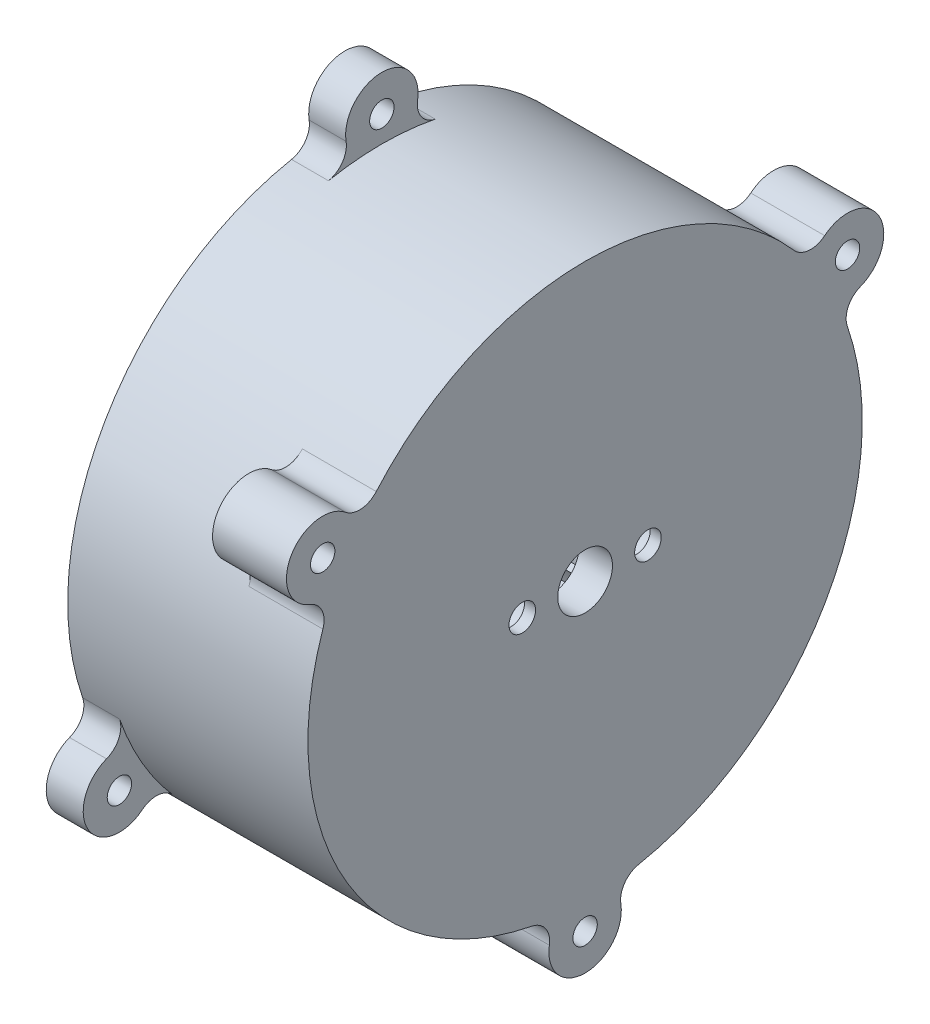
from build123d import *

# Parameters (mm, degrees)
BASPROSKE_W         = 28
BASPROSKE_H         = 4.375
TOOTHCUT_DEPTH      = 60.970826241
TEETHCUTS_COUNT     = 55
TEETHCUTS_ANGLE     = 353.454545455
BOSS_EXTRUDE1_START = 4.5
SKETCH1_R           = 37.5
BOSS_EXTRUDE1_DEPTH = 4.5
SKETCH2_R           = 3.7
SKETCH2_R_2         = 1.8
CUT_EXTRUDE1_DEPTH  = 4.5
SKETCH3_R           = 3.25
CUT_EXTRUDE2_DEPTH  = 3
BOSS_EXTRUDE2_START = -5
SKETCH4_R           = 1.65
BOSS_EXTRUDE2_DEPTH = 5
FILLET1_R           = 3
SKETCH5_R           = 1.65
BOSS_EXTRUDE3_DEPTH = 10
FILLET2_R           = 3


with BuildPart() as part:
    # BasProSke → Base-Revolve (revolve)
    with BuildSketch(Plane(origin=(0, 0, 0), x_dir=(1, 0, 0), z_dir=(0, 1, 0)), mode=Mode.PRIVATE) as base_revolve_sk:
        with Locations((14, 35.3125)):
            Rectangle(BASPROSKE_W, BASPROSKE_H)
    revolve(base_revolve_sk.sketch.rotate(Axis((-10, 0, 0), (1, 0, 0)), 180), axis=Axis((-10, 0, 0), (1, 0, 0)))

    # TooCutSke → ToothCut (cut, through all)
    with BuildSketch(Plane(origin=(0, 0, 0), x_dir=(0, 0, -1), z_dir=(1, 0, 0))):
        with BuildLine():
            ThreePointArc((1.451447951, 33.067761022), (1.040603726, 34.522224287), (0.503573985, 35.934971761))
            ThreePointArc((0.503573985, 35.934971761), (0, 35.9385), (-0.503573985, 35.934971761))
            ThreePointArc((-0.503573985, 35.934971761), (-1.040603726, 34.522224287), (-1.451447951, 33.067761022))
            ThreePointArc((-1.451447951, 33.067761022), (0, 33.0996), (1.451447951, 33.067761022))
        make_face()
    toothcut = extrude(amount=TOOTHCUT_DEPTH, mode=Mode.SUBTRACT)

    # TeethCuts: ToothCut ×55 about axis
    teethcuts_axis = Axis((-10, 0, 0), (1, 0, 0))
    for i in range(1, TEETHCUTS_COUNT):
        add(toothcut.rotate(teethcuts_axis, i * TEETHCUTS_ANGLE / (TEETHCUTS_COUNT - 1)), mode=Mode.SUBTRACT)

    # Sketch1 → Boss-Extrude1 (add)
    with BuildSketch(Plane(origin=(28, 0, 0), x_dir=(0, 0, -1), z_dir=(1, 0, 0)).offset(BOSS_EXTRUDE1_START)):
        with Locations(Location((0, 0, 0), (0, 0, 180))):
            Circle(SKETCH1_R)
    extrude(amount=-BOSS_EXTRUDE1_DEPTH)

    # Sketch2 → Cut-Extrude1 (cut)
    with BuildSketch(Plane(origin=(32.5, 0, 0), x_dir=(0, 0, -1), z_dir=(1, 0, 0))):
        Circle(SKETCH2_R)
        with Locations((-8.5, 0)):
            Circle(SKETCH2_R_2)
        with Locations((8.5, 0)):
            Circle(SKETCH2_R_2)
    extrude(amount=-CUT_EXTRUDE1_DEPTH, mode=Mode.SUBTRACT)

    # Sketch3 → Cut-Extrude2 (cut)
    with BuildSketch(Plane.ZY.offset(-28)):
        with Locations((-8.5, 0)):
            Circle(SKETCH3_R)
        with Locations((8.5, 0)):
            Circle(SKETCH3_R)
    extrude(amount=-CUT_EXTRUDE2_DEPTH, mode=Mode.SUBTRACT)

    # Sketch4 → Boss-Extrude2 (add)
    # profile 1 of 3: a face of its own
    with BuildSketch(Plane.ZY.offset(BOSS_EXTRUDE2_START)):
        with BuildLine():
            ThreePointArc((-3.276511835, 37.356585366), (0, 45.9), (3.276511835, 37.356585366))
            ThreePointArc((3.276511835, 37.356585366), (0, 37.5), (-3.276511835, 37.356585366))
        make_face()
        with Locations((0, 41)):
            Circle(SKETCH4_R, mode=Mode.SUBTRACT)
    # profile 2 of 3: a face of its own
    with BuildSketch(Plane.ZY.offset(BOSS_EXTRUDE2_START)):
        with BuildLine():
            ThreePointArc((33.990007843, -15.840750198), (39.750566034, -22.95), (30.713496008, -21.515835168))
            ThreePointArc((30.713496008, -21.515835168), (32.475952642, -18.75), (33.990007843, -15.840750198))
        make_face()
        with Locations((35.507041555, -20.5)):
            Circle(SKETCH4_R, mode=Mode.SUBTRACT)
    # profile 3 of 3: a face of its own
    with BuildSketch(Plane.ZY.offset(BOSS_EXTRUDE2_START)):
        with BuildLine():
            ThreePointArc((-30.713496008, -21.515835168), (-39.750566034, -22.95), (-33.990007843, -15.840750198))
            ThreePointArc((-33.990007843, -15.840750198), (-32.475952642, -18.75), (-30.713496008, -21.515835168))
        make_face()
        with Locations((-35.507041555, -20.5)):
            Circle(SKETCH4_R, mode=Mode.SUBTRACT)
    extrude(amount=BOSS_EXTRUDE2_DEPTH)

    # Fillet1
    fillet1_edges = [part.edges().sort_by_distance(p)[0] for p in [
        (2.5, 37.356585366, 3.276511835),
        (2.5, 37.356585366, -3.276511835),
        (2.5, -21.515835168, 30.713496008),
        (2.5, -15.840750198, 33.990007843),
        (2.5, -15.840750198, -33.990007843),
        (2.5, -21.515835168, -30.713496008),
    ]]
    fillet(fillet1_edges, radius=FILLET1_R)

    # Sketch5 → Boss-Extrude3 (add)
    # profile 1 of 3: a face of its own
    with BuildSketch(Plane(origin=(32.5, 0, 0), x_dir=(0, 0, -1), z_dir=(1, 0, 0))):
        with BuildLine():
            ThreePointArc((33.990007843, 15.840750198), (39.750566034, 22.95), (30.713496008, 21.515835168))
            ThreePointArc((30.713496008, 21.515835168), (32.475952642, 18.75), (33.990007843, 15.840750198))
        make_face()
        with Locations((35.507041555, 20.5)):
            Circle(SKETCH5_R, mode=Mode.SUBTRACT)
    # profile 2 of 3: a face of its own
    with BuildSketch(Plane(origin=(32.5, 0, 0), x_dir=(0, 0, -1), z_dir=(1, 0, 0))):
        with BuildLine():
            ThreePointArc((-3.276511835, -37.356585366), (0, -45.9), (3.276511835, -37.356585366))
            ThreePointArc((3.276511835, -37.356585366), (0, -37.5), (-3.276511835, -37.356585366))
        make_face()
        with Locations((0, -41)):
            Circle(SKETCH5_R, mode=Mode.SUBTRACT)
    # profile 3 of 3: a face of its own
    with BuildSketch(Plane(origin=(32.5, 0, 0), x_dir=(0, 0, -1), z_dir=(1, 0, 0))):
        with BuildLine():
            ThreePointArc((-30.713496008, 21.515835168), (-39.750566034, 22.95), (-33.990007843, 15.840750198))
            ThreePointArc((-33.990007843, 15.840750198), (-32.475952642, 18.75), (-30.713496008, 21.515835168))
        make_face()
        with Locations((-35.507041555, 20.5)):
            Circle(SKETCH5_R, mode=Mode.SUBTRACT)
    extrude(amount=-BOSS_EXTRUDE3_DEPTH)

    # Fillet2
    fillet2_edges = [part.edges().sort_by_distance(p)[0] for p in [
        (27.5, 15.840750198, -33.990007843),
        (27.5, 21.515835168, -30.713496008),
        (27.5, -37.356585366, 3.276511835),
        (27.5, -37.356585366, -3.276511835),
        (27.5, 21.515835168, 30.713496008),
        (27.5, 15.840750198, 33.990007843),
    ]]
    fillet(fillet2_edges, radius=FILLET2_R)


solid = part.part
